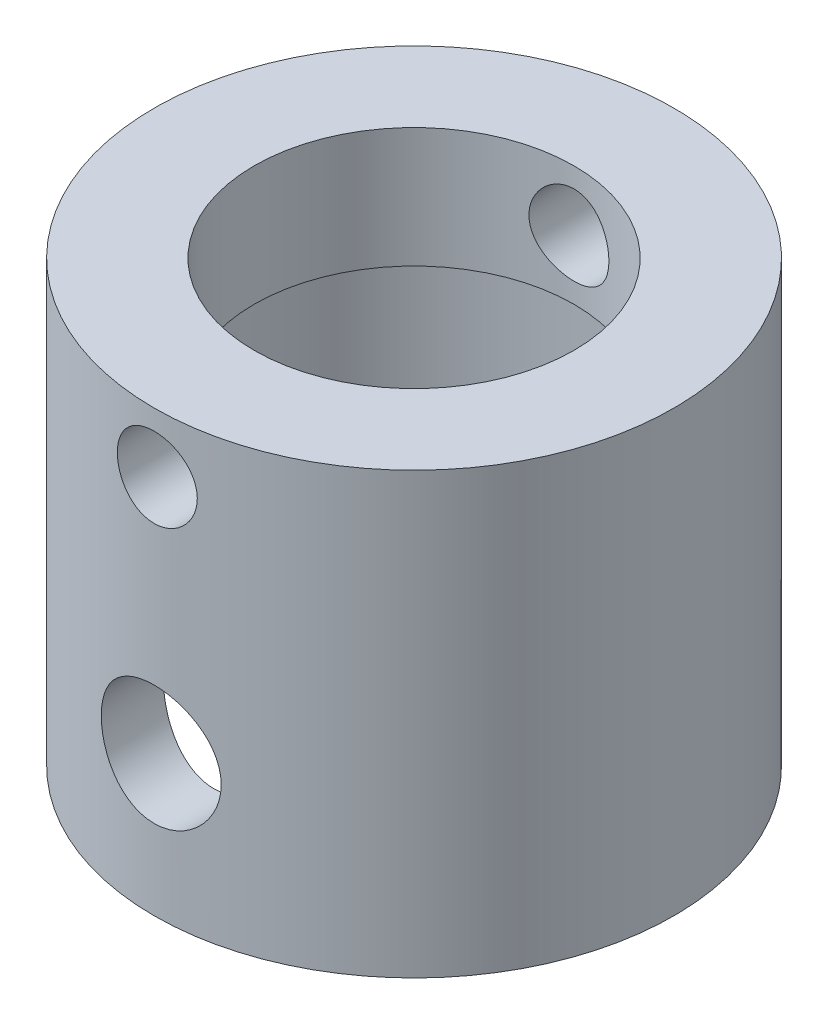
from build123d import *

# Parameters (mm, degrees)
EXTRUDE_START            = -16
SKETCH_1_R               = 13
EXTRUDE_1_DEPTH          = 22
CUT_EXTRUDE_1_REACH      = 26.372
SKETCH_2_R               = 8
CUT_EXTRUDE_2_REACH      = 26.372
SKETCH_3_R               = 10
CUT_EXTRUDE_3_DEPTH      = 25.372115214
CUT_EXTRUDE_3_DEPTH_BACK = 25.372115214
SKETCH_4_R               = 3
SKETCH_4_R_2             = 2


with BuildPart() as part:
    # 草图1 → 凸台-拉伸1 (new body)
    with BuildSketch(Plane(origin=(0, 0, 0), x_dir=(1, 0, 0), z_dir=(0, 1, 0)).offset(EXTRUDE_START)):
        with Locations(Location((0, 0, 0), (0, 0, 270))):
            Circle(SKETCH_1_R)
    extrude(amount=EXTRUDE_1_DEPTH)

    # 草图2 → 切除-拉伸1 (cut, up to next)
    with BuildSketch(Plane(origin=(0, 0, 0), x_dir=(1, 0, 0), z_dir=(0, 1, 0)), mode=Mode.PRIVATE) as cut_extrude_1_sk1:
        with Locations(Location((0, 0, 0), (0, 0, 270))):
            Circle(SKETCH_2_R)
    cut_extrude_1_tool1 = extrude(cut_extrude_1_sk1.sketch, amount=CUT_EXTRUDE_1_REACH, mode=Mode.PRIVATE) & part.part
    add(cut_extrude_1_tool1.solids().sort_by_distance((0, 0, 0))[0], mode=Mode.SUBTRACT)

    # 草图3 → 切除-拉伸2 (cut, up to next)
    with BuildSketch(Plane(origin=(0, 0, 0), x_dir=(1, 0, 0), z_dir=(0, 1, 0)), mode=Mode.PRIVATE) as cut_extrude_2_sk1:
        with Locations(Location((0, 0, 0), (0, 0, 270))):
            Circle(SKETCH_3_R)
    cut_extrude_2_tool1 = extrude(cut_extrude_2_sk1.sketch, amount=-CUT_EXTRUDE_2_REACH, mode=Mode.PRIVATE) & part.part
    add(cut_extrude_2_tool1.solids().sort_by_distance((0, 0, 0))[0], mode=Mode.SUBTRACT)

    # 草图4 → 切除-拉伸3 (cut, two sides: drawn at the far end of the back side and taken through both)
    with BuildSketch(Plane.XY.offset(-CUT_EXTRUDE_3_DEPTH_BACK)):
        with Locations((0, -9)):
            Circle(SKETCH_4_R)
        with Locations((0, 3)):
            Circle(SKETCH_4_R_2)
    extrude(amount=CUT_EXTRUDE_3_DEPTH + CUT_EXTRUDE_3_DEPTH_BACK, mode=Mode.SUBTRACT)


solid = part.part
